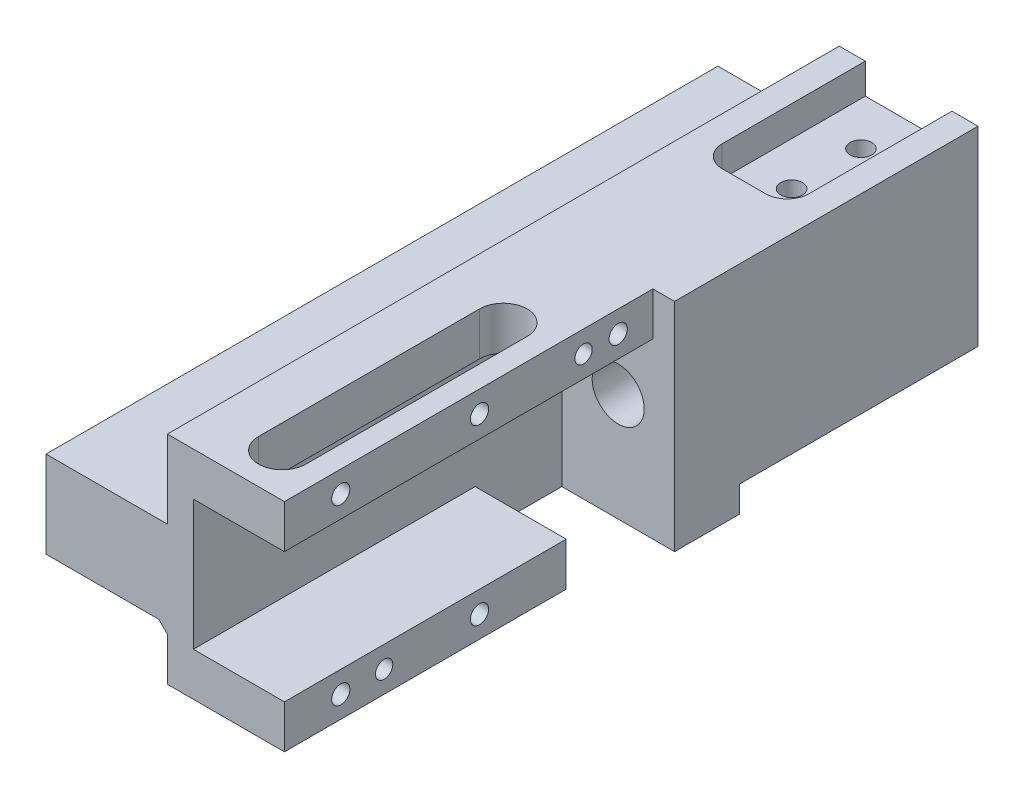
from build123d import *

# Parameters (mm, degrees)
EXTRUDE_1_DEPTH          = 155
EXTRUDE_2_REACH          = 173.901
SKETCH_2_W               = 32
SKETCH_2_H               = 70
CUT_EXTRUDE_1_DEPTH      = 172.901134377
CUT_EXTRUDE_1_DEPTH_BACK = 7
CUT_EXTRUDE_2_REACH      = 173.901
CUT_EXTRUDE_3_REACH      = 114.916
SKETCH_5_R               = 6
CUT_EXTRUDE_START        = -70
SKETCH_6_R               = 10.5
CUT_EXTRUDE_4_DEPTH      = 55
M24X2_0_1_D              = 22
M24X2_0_1_DEPTH          = 15
M24X2_0_1_TIP            = 6.609466809
HOLE_WIZARD_M6_1_REACH   = 171.997
HOLE_WIZARD_M6_1_BORE_R  = 2.5
HOLE_WIZARD_M5_1_D       = 4.2
HOLE_WIZARD_M5_1_DEPTH   = 5
SKETCH_15_W              = 20
SKETCH_15_H              = 10
CUT_EXTRUDE_5_DEPTH      = 21
HOLE_WIZARD_M5_2_D       = 4.2
HOLE_WIZARD_M5_2_DEPTH   = 13
HOLE_WIZARD_M5_2_TIP     = 1.2618073
F_4_0MM_1_D              = 4
F_4_0MM_1_DEPTH          = 12
F_4_0MM_1_TIP            = 1.201721238
CUT_EXTRUDE_7_DEPTH      = 172.901134467
CUT_EXTRUDE_7_DEPTH_BACK = 6
F_4_0MM_2_D              = 4
F_4_0MM_2_DEPTH          = 10
F_4_0MM_2_TIP            = 1.201721238
HOLE_WIZARD_M6_2_D       = 5
HOLE_WIZARD_M6_2_DEPTH   = 12
HOLE_WIZARD_M6_2_TIP     = 1.502151548
CHAMFER_1_SIZE           = 2


with BuildPart() as part:
    # 草图1 → 凸台-拉伸1 (new body)
    with BuildSketch(Plane.XY):
        Polygon((0, 0), (-27, 0), (-27, 12), (-55, 12), (-55, 32), (-27, 32), (-27, 50), (0, 50), (0, 40), (-21, 40), (-21, 10), (0, 10), align=None)
    extrude(amount=-EXTRUDE_1_DEPTH)

    # 凸台-拉伸2: up to this face of the body (flat: up to its plane)
    extrude_2_end = Plane(part.part.faces().sort_by_distance((-13.5, 50, -77.5))[0])
    # 草图2 → 凸台-拉伸2 (add, up to the picked face)
    with BuildSketch(Plane(origin=(0, 0, 0), x_dir=(1, 0, 0), z_dir=(0, 1, 0)), mode=Mode.PRIVATE) as extrude_2_sk1:
        with Locations((-11, 120)):
            Rectangle(SKETCH_2_W, SKETCH_2_H)
    extrude_2_tool1 = split(extrude(extrude_2_sk1.sketch, amount=EXTRUDE_2_REACH, mode=Mode.PRIVATE), bisect_by=extrude_2_end, keep=Keep.BOTH, mode=Mode.PRIVATE)
    add(extrude_2_tool1.solids().sort_by(Axis((-11, 0, -120), (0, 1, 0)))[0])

    # 草图3 → 切除-拉伸1 (cut, two sides: drawn at the far end of the back side and taken through both)
    with BuildSketch(Plane(origin=(0, 50, 0), x_dir=(1, 0, 0), z_dir=(0, 1, 0)).offset(-CUT_EXTRUDE_1_DEPTH_BACK)):
        with BuildLine():
            Line((-6, 117), (-16, 117))
            ThreePointArc((-16, 117), (-19.535533906, 118.464466094), (-21, 122))
            Line((-21, 122), (-21, 155))
            Line((-21, 155), (-1, 155))
            Line((-1, 155), (-1, 122))
            ThreePointArc((-1, 122), (-2.464466094, 118.464466094), (-6, 117))
        make_face()
    extrude(amount=CUT_EXTRUDE_1_DEPTH + CUT_EXTRUDE_1_DEPTH_BACK, mode=Mode.SUBTRACT)

    # 草图4 → 切除-拉伸2 (cut, up to next)
    with BuildSketch(Plane(origin=(0, 50, 0), x_dir=(1, 0, 0), z_dir=(0, 1, 0)), mode=Mode.PRIVATE) as cut_extrude_2_sk1:
        with BuildLine():
            Line((-16, 10), (-16, 61))
            ThreePointArc((-16, 61), (-10.5, 66.5), (-5, 61))
            Line((-5, 61), (-5, 10))
            ThreePointArc((-5, 10), (-10.5, 4.5), (-16, 10))
        make_face()
    cut_extrude_2_tool1 = extrude(cut_extrude_2_sk1.sketch, amount=-CUT_EXTRUDE_2_REACH, mode=Mode.PRIVATE) & part.part
    add(cut_extrude_2_tool1.solids().sort_by_distance((-10.5, 50, -35.5))[0], mode=Mode.SUBTRACT)

    # 草图5 → 切除-拉伸3 (cut, up to next)
    with BuildSketch(Plane.XY.offset(-85), mode=Mode.PRIVATE) as cut_extrude_3_sk1:
        with Locations((-8, 25)):
            Circle(SKETCH_5_R)
    cut_extrude_3_tool1 = extrude(cut_extrude_3_sk1.sketch, amount=-CUT_EXTRUDE_3_REACH, mode=Mode.PRIVATE) & part.part
    add(cut_extrude_3_tool1.solids().sort_by_distance((-8, 25, -85))[0], mode=Mode.SUBTRACT)

    # 草图6 → 切除-拉伸4 (cut)
    with BuildSketch(Plane.XY.offset(-85).offset(CUT_EXTRUDE_START)):
        with Locations(Location((-8, 25, 0), (0, 0, 180))):
            Circle(SKETCH_6_R)
    extrude(amount=CUT_EXTRUDE_4_DEPTH, mode=Mode.SUBTRACT)

    # M24x2.0 螺纹孔1
    with Locations(Plane(origin=(0, 0, -155), x_dir=(-1, 0, 0), z_dir=(0, 0, -1))):
        with Locations((8, 25)):
            Hole(M24X2_0_1_D / 2, depth=M24X2_0_1_DEPTH)
            with Locations((0, 0, -(M24X2_0_1_DEPTH + M24X2_0_1_TIP / 2))):  # 118° drill point
                Cone(0, M24X2_0_1_D / 2, M24X2_0_1_TIP, mode=Mode.SUBTRACT)

    # M6 螺纹孔1 bore → M6 螺纹孔1 (cut, up to next)
    with BuildSketch(Plane(origin=(0, 43, 0), x_dir=(1, 0, 0), z_dir=(0, 1, 0)), mode=Mode.PRIVATE) as hole_wizard_m6_1_sk1:
        with Locations((-11, 144)):
            Circle(HOLE_WIZARD_M6_1_BORE_R)
    hole_wizard_m6_1_tool1 = extrude(hole_wizard_m6_1_sk1.sketch, amount=-HOLE_WIZARD_M6_1_REACH, mode=Mode.PRIVATE) & part.part
    # M6 螺纹孔1 bore → M6 螺纹孔1 (cut, up to next)
    with BuildSketch(Plane(origin=(0, 43, 0), x_dir=(1, 0, 0), z_dir=(0, 1, 0)), mode=Mode.PRIVATE) as hole_wizard_m6_1_sk2:
        with Locations((-11, 128)):
            Circle(HOLE_WIZARD_M6_1_BORE_R)
    hole_wizard_m6_1_tool2 = extrude(hole_wizard_m6_1_sk2.sketch, amount=-HOLE_WIZARD_M6_1_REACH, mode=Mode.PRIVATE) & part.part
    add(hole_wizard_m6_1_tool1.solids().sort_by_distance((-11, 43, -144))[0], mode=Mode.SUBTRACT)
    add(hole_wizard_m6_1_tool2.solids().sort_by_distance((-11, 43, -128))[0], mode=Mode.SUBTRACT)

    # M5 螺纹孔1
    with Locations(Plane(origin=(0, 0, 0), x_dir=(0, 0, -1), z_dir=(1, 0, 0))):
        with Locations((13, 45), (45, 45)):
            Hole(HOLE_WIZARD_M5_1_D / 2, depth=HOLE_WIZARD_M5_1_DEPTH)

    # 草图15 → 切除-拉伸5 (cut)
    with BuildSketch(Plane(origin=(0, 0, 0), x_dir=(0, 0, -1), z_dir=(1, 0, 0))):
        with Locations((75, 5)):
            Rectangle(SKETCH_15_W, SKETCH_15_H)
    extrude(amount=-CUT_EXTRUDE_5_DEPTH, mode=Mode.SUBTRACT)

    # M5 螺纹孔2
    with Locations(Plane(origin=(0, 0, 0), x_dir=(0, 0, -1), z_dir=(1, 0, 0))):
        with Locations((13, 5), (45, 5), (77, 45)):
            Hole(HOLE_WIZARD_M5_2_D / 2, depth=HOLE_WIZARD_M5_2_DEPTH)
            with Locations((0, 0, -(HOLE_WIZARD_M5_2_DEPTH + HOLE_WIZARD_M5_2_TIP / 2))):  # 118° drill point
                Cone(0, HOLE_WIZARD_M5_2_D / 2, HOLE_WIZARD_M5_2_TIP, mode=Mode.SUBTRACT)

    # Ø4.0mm 暗销孔1
    with Locations(Plane(origin=(0, 0, 0), x_dir=(0, 0, -1), z_dir=(1, 0, 0))):
        with Locations((23, 5), (69, 45)):
            Hole(F_4_0MM_1_D / 2, depth=F_4_0MM_1_DEPTH)
            with Locations((0, 0, -(F_4_0MM_1_DEPTH + F_4_0MM_1_TIP / 2))):  # 118° drill point
                Cone(0, F_4_0MM_1_D / 2, F_4_0MM_1_TIP, mode=Mode.SUBTRACT)

    # 草图22 → 切除-拉伸7 (cut, two sides: drawn at the far end of the back side and taken through both)
    with BuildSketch(Plane.XZ.offset(-CUT_EXTRUDE_7_DEPTH_BACK)):
        with BuildLine():
            Line((308.073369653, -100), (5, -100))
            Line((5, -100), (-4, -100))
            ThreePointArc((-4, -100), (-8.242640687, -101.757359313), (-10, -106))
            Line((-10, -106), (-10, -143))
            Line((-10, -143), (-27, -143))
            Line((-27, -143), (-330.073369653, -143))
            Line((-330.073369653, -143), (-289.322022823, -747.775327956))
            Line((-289.322022823, -747.775327956), (348.824716484, -704.775327956))
            Line((348.824716484, -704.775327956), (308.073369653, -100))
        make_face()
    extrude(amount=CUT_EXTRUDE_7_DEPTH + CUT_EXTRUDE_7_DEPTH_BACK, mode=Mode.SUBTRACT)

    # Ø4.0mm 暗销孔2
    with Locations(Plane(origin=(0, 6, 0), x_dir=(-1, 0, 0), z_dir=(0, -1, 0))):
        with Locations((6, 127), (6, 107)):
            Hole(F_4_0MM_2_D / 2, depth=F_4_0MM_2_DEPTH)
            with Locations((0, 0, -(F_4_0MM_2_DEPTH + F_4_0MM_2_TIP / 2))):  # 118° drill point
                Cone(0, F_4_0MM_2_D / 2, F_4_0MM_2_TIP, mode=Mode.SUBTRACT)

    # M6 螺纹孔2
    with Locations(Plane(origin=(0, 6, 0), x_dir=(-1, 0, 0), z_dir=(0, -1, 0))):
        with Locations((2.5, 136), (2.5, 116)):
            Hole(HOLE_WIZARD_M6_2_D / 2, depth=HOLE_WIZARD_M6_2_DEPTH)
            with Locations((0, 0, -(HOLE_WIZARD_M6_2_DEPTH + HOLE_WIZARD_M6_2_TIP / 2))):  # 118° drill point
                Cone(0, HOLE_WIZARD_M6_2_D / 2, HOLE_WIZARD_M6_2_TIP, mode=Mode.SUBTRACT)

    # 倒角1
    chamfer_1_edges = [part.edges().sort_by_distance(p)[0] for p in [
        (-27, 12, -77.5),
    ]]
    chamfer(chamfer_1_edges, length=CHAMFER_1_SIZE)


solid = part.part
